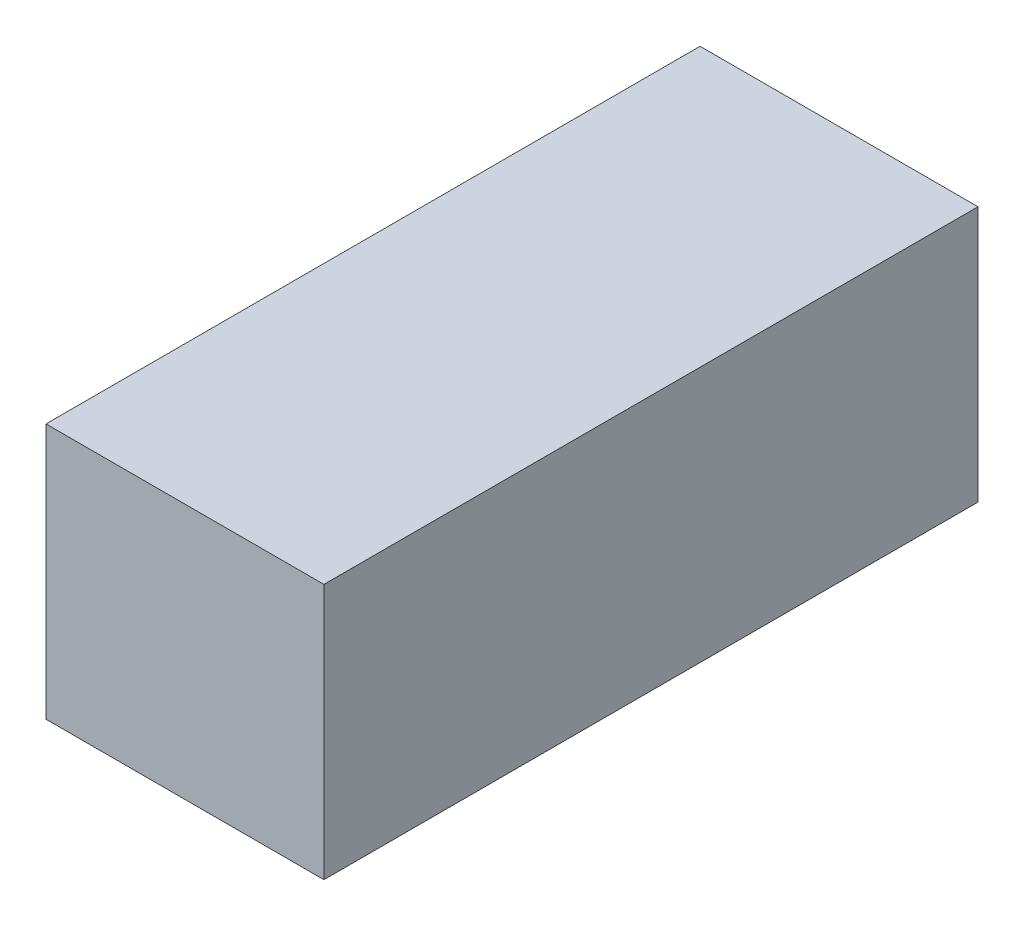
from build123d import *

# Parameters (mm, degrees)
ESTRUSIONE_ESTRUSIONE1_DEPTH      = 41.3
ESTRUSIONE_ESTRUSIONE1_DEPTH_BACK = 41.3
SCHIZZO1_W                        = 35.1
SCHIZZO1_H                        = 32.3


with BuildPart() as part:
    # Schizzo1 → Estrusione-Estrusione1 (new, two sides: drawn at the far end of the back side and taken through both)
    with BuildSketch(Plane.XY.offset(-ESTRUSIONE_ESTRUSIONE1_DEPTH_BACK)):
        Rectangle(SCHIZZO1_W, SCHIZZO1_H)
    extrude(amount=ESTRUSIONE_ESTRUSIONE1_DEPTH + ESTRUSIONE_ESTRUSIONE1_DEPTH_BACK)


solid = part.part
